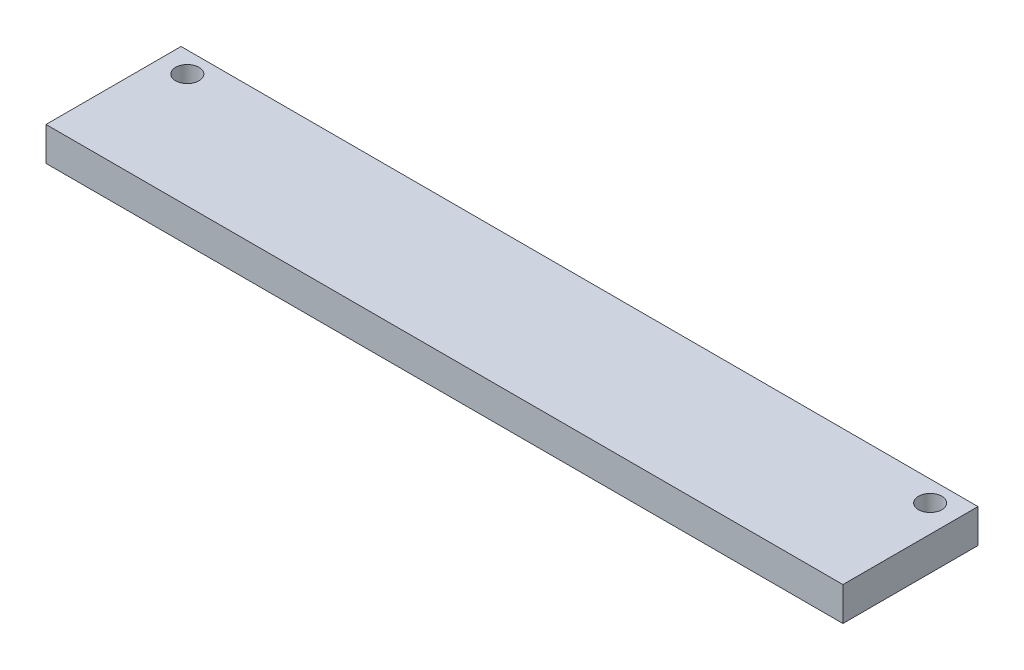
from build123d import *

# Parameters (mm, degrees)
ESBO_O1_W                = 74.93
ESBO_O1_H                = 12.7
RESSALTO_EXTRUS_O1_DEPTH = 3.175
ESBO_O2_R                = 1.1
CORTE_EXTRUS_O1_DEPTH    = 12.175


with BuildPart() as part:
    # Esboço1 → Ressalto-extrusão1 (new body)
    with BuildSketch(Plane(origin=(0, 0, 0), x_dir=(1, 0, 0), z_dir=(0, 1, 0))):
        with Locations((-7.430597687, -0.654986873)):
            Rectangle(ESBO_O1_W, ESBO_O1_H)
    extrude(amount=RESSALTO_EXTRUS_O1_DEPTH)

    # Esboço2 → Corte-extrusão1 (cut)
    with BuildSketch(Plane.XZ):
        with Locations(Location((27.494402313, -3.739192561, 0), (0, 0, 270))):
            Circle(ESBO_O2_R)
        with Locations(Location((-42.355597687, -3.739192561, 0), (0, 0, 270))):
            Circle(ESBO_O2_R)
    extrude(amount=-CORTE_EXTRUS_O1_DEPTH, mode=Mode.SUBTRACT)


solid = part.part
